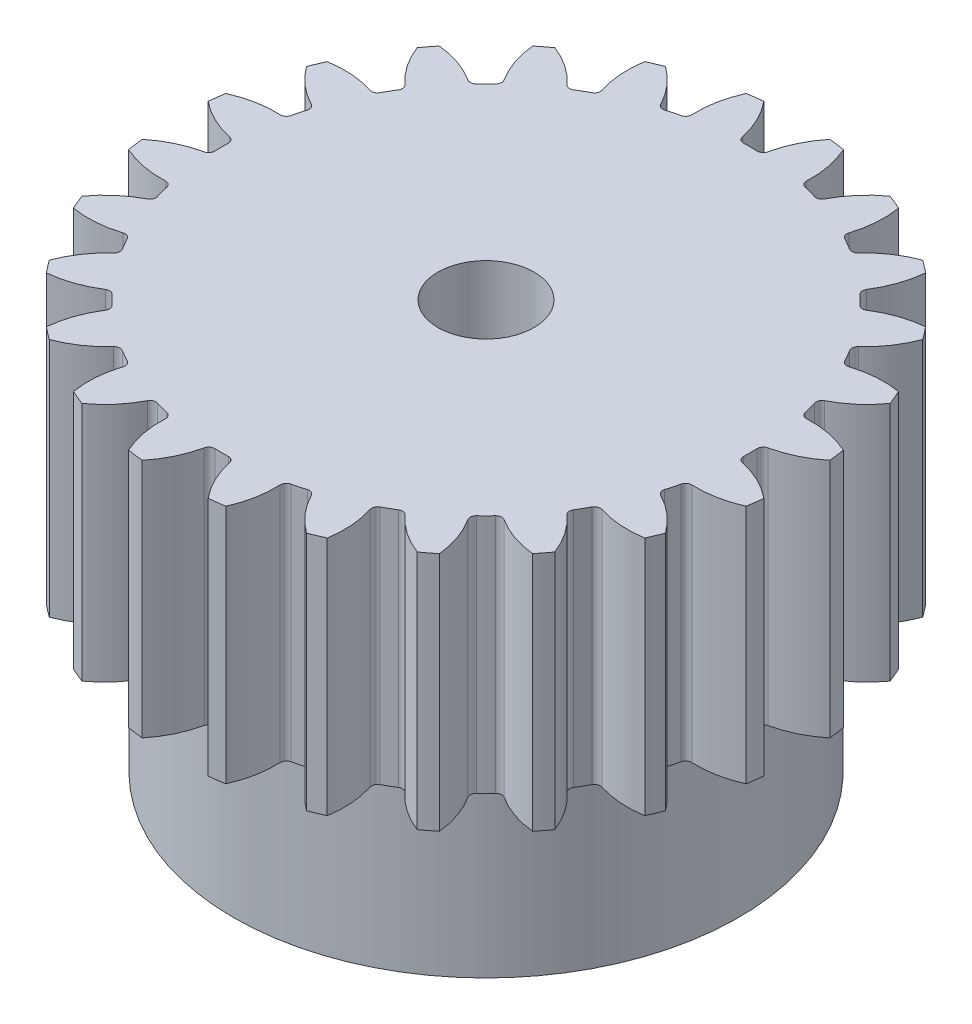
from build123d import *

# Parameters (mm, degrees)
SKETCH_1_R               = 26
EXTRUDE_1_DEPTH          = 20
SKETCH_2_R               = 21
EXTRUDE_2_DEPTH          = 14
CUT_EXTRUDE_1_REACH      = 43.857
PATTERN_CIRCULAR_1_COUNT = 24
CUT_EXTRUDE_2_DEPTH      = 42.676911108
CUT_EXTRUDE_2_DEPTH_BACK = 42.676911108
SKETCH_5_R               = 4


with BuildPart() as part:
    # 草图1 → 凸台-拉伸1 (new body)
    with BuildSketch(Plane(origin=(0, 0, 0), x_dir=(1, 0, 0), z_dir=(0, 1, 0))):
        with Locations(Location((0, 0, 0), (0, 0, 270))):
            Circle(SKETCH_1_R)
    extrude(amount=EXTRUDE_1_DEPTH)

    # 草图2 → 凸台-拉伸2 (add)
    with BuildSketch(Plane(origin=(0, 0, 0), x_dir=(1, 0, 0), z_dir=(0, 1, 0))):
        with Locations(Location((0, 0, 0), (0, 0, 270))):
            Circle(SKETCH_2_R)
    extrude(amount=-EXTRUDE_2_DEPTH)

    # 草图4 → 切除-拉伸1 (cut, up to next)
    with BuildSketch(Plane(origin=(0, 0, 0), x_dir=(1, 0, 0), z_dir=(0, 1, 0)), mode=Mode.PRIVATE) as cut_extrude_1_sk1:
        with BuildLine():
            ThreePointArc((2.741813312, 25.855027746), (1.695394394, 24.220742425), (1.06187474, 22.386475838))
            ThreePointArc((1.06187474, 22.386475838), (0.882061796, 22.099428872), (0.560547841, 21.992857616))
            ThreePointArc((0.560547841, 21.992857616), (0, 22), (-0.560547841, 21.992857616))
            ThreePointArc((-0.560547841, 21.992857616), (-0.882061796, 22.099428872), (-1.06187474, 22.386475838))
            ThreePointArc((-1.06187474, 22.386475838), (-1.695394394, 24.220742425), (-2.741813312, 25.855027746))
            ThreePointArc((-2.741813312, 25.855027746), (0, 26), (2.741813312, 25.855027746))
        make_face()
    cut_extrude_1_tool1 = extrude(cut_extrude_1_sk1.sketch, amount=CUT_EXTRUDE_1_REACH, mode=Mode.PRIVATE) & part.part
    cut_extrude_1 = cut_extrude_1_tool1.solids().sort_by_distance((0, 0, -24.336645))[0]
    add(cut_extrude_1, mode=Mode.SUBTRACT)

    # 阵列(圆周)1: 切除-拉伸1 ×24 about axis
    pattern_circular_1_axis = Axis((0, 0, 0), (0, 1, 0))
    for i in range(1, PATTERN_CIRCULAR_1_COUNT):
        add(cut_extrude_1.rotate(pattern_circular_1_axis, i * 360 / PATTERN_CIRCULAR_1_COUNT), mode=Mode.SUBTRACT)

    # 草图5 → 切除-拉伸2 (cut, two sides: drawn at the far end of the back side and taken through both)
    with BuildSketch(Plane(origin=(0, 0, 0), x_dir=(1, 0, 0), z_dir=(0, 1, 0)).offset(-CUT_EXTRUDE_2_DEPTH_BACK)):
        with Locations(Location((0, 0, 0), (0, 0, 270))):
            Circle(SKETCH_5_R)
    extrude(amount=CUT_EXTRUDE_2_DEPTH + CUT_EXTRUDE_2_DEPTH_BACK, mode=Mode.SUBTRACT)


solid = part.part
